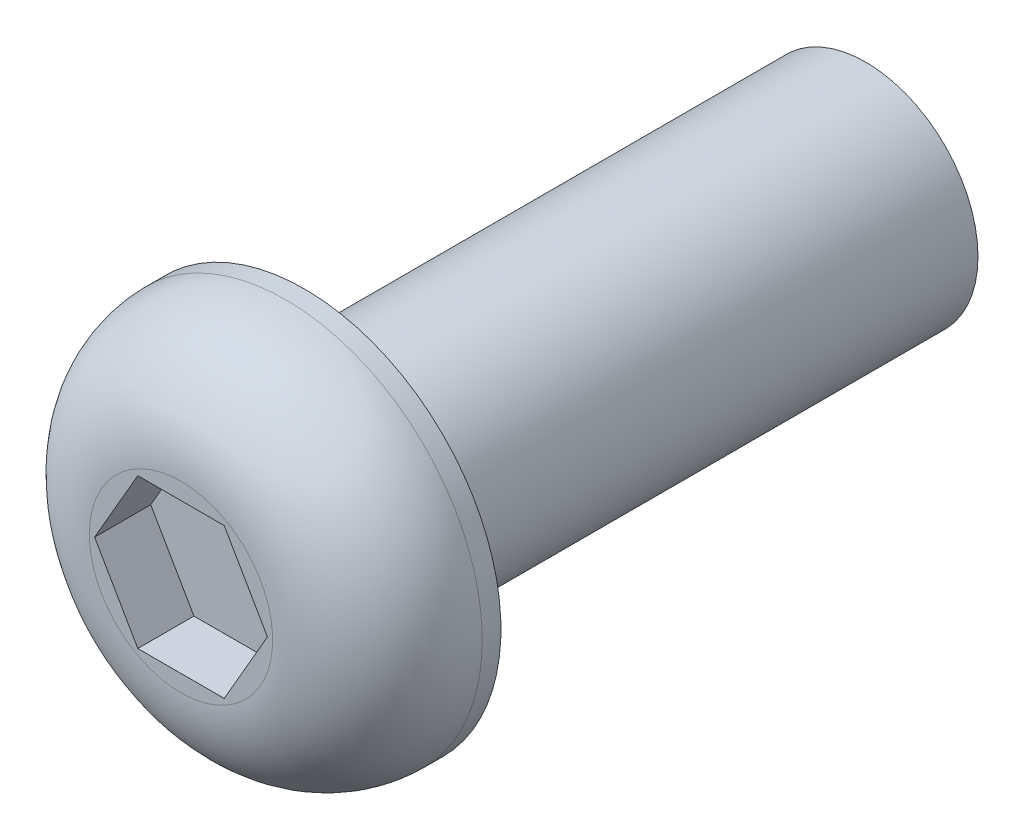
from build123d import *

# Parameters (mm, degrees)
SKETCH1_R          = 6
EXTRUDE1_DEPTH     = 30
CUT_EXTRUDE1_DEPTH = 3


with BuildPart() as part:
    # Sketch1 → Extrude1 (new body)
    with BuildSketch(Plane.XY):
        Circle(SKETCH1_R)
    extrude(amount=-EXTRUDE1_DEPTH)

    # Sketch2 → Revolve1 (revolve)
    with BuildSketch(Plane(origin=(0, 0, 0), x_dir=(0, 0, -1), z_dir=(1, 0, 0)), mode=Mode.PRIVATE) as revolve1_sk:
        with BuildLine():
            Line((0, 0), (0, 10.5))
            Line((0, 10.5), (-1, 10.5))
            ThreePointArc((-1, 10.5), (-4.959797975, 8.859797975), (-6.6, 4.9))
            Line((-6.6, 4.9), (-6.6, 0))
            Line((-6.6, 0), (0, 0))
        make_face()
    revolve(revolve1_sk.sketch.rotate(Axis((0, 0, 0), (0, 0, 1)), 90), axis=Axis((0, 0, 0), (0, 0, 1)))

    # Sketch3 → Cut-Extrude1 (cut)
    with BuildSketch(Plane.XY.offset(6.6)):
        Polygon((-2.309401077, 4), (-4.618802154, 0), (-2.309401077, -4), (2.309401077, -4), (4.618802154, 0), (2.309401077, 4), align=None)
    extrude(amount=-CUT_EXTRUDE1_DEPTH, mode=Mode.SUBTRACT)


solid = part.part
